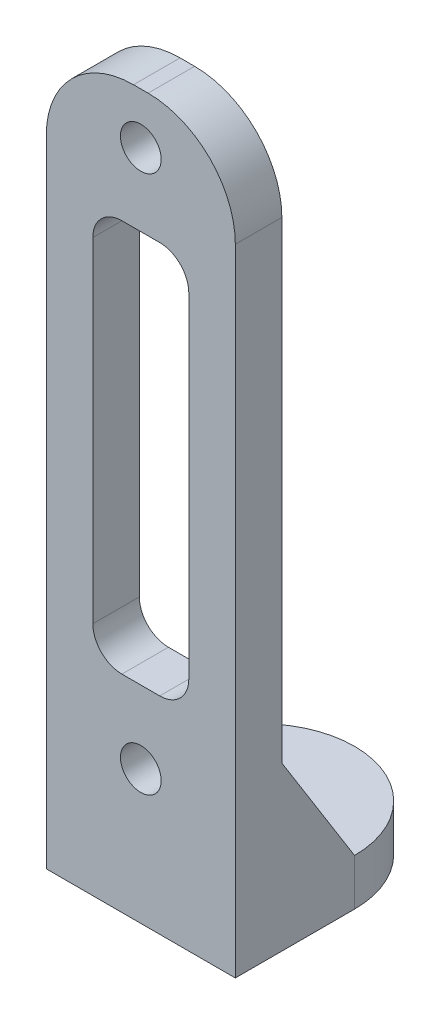
from build123d import *

# Parameters (mm, degrees)
SKETCH1_R           = 1.4
BOSS_EXTRUDE1_DEPTH = 3.2
SKETCH2_R           = 1.65
BOSS_EXTRUDE3_DEPTH = 3.2
BOSS_EXTRUDE4_DEPTH = 2
LPATTERN1_COUNT     = 2
LPATTERN1_PITCH     = 11
CUT_EXTRUDE1_DEPTH  = 50.633657935


with BuildPart() as part:
    # Sketch1 → Boss-Extrude1 (new body)
    with BuildSketch(Plane.XY):
        with BuildLine():
            Line((0, 0), (13, 0))
            Line((13, 0), (13, 40.5))
            ThreePointArc((13, 40.5), (11.242640687, 44.742640687), (7, 46.5))
            Line((7, 46.5), (6, 46.5))
            ThreePointArc((6, 46.5), (1.757359313, 44.742640687), (0, 40.5))
            Line((0, 40.5), (0, 0))
        make_face()
        with Locations((6.5, 6)):
            Circle(SKETCH1_R, mode=Mode.SUBTRACT)
        with Locations((6.5, 43)):
            Circle(SKETCH1_R, mode=Mode.SUBTRACT)
    extrude(amount=BOSS_EXTRUDE1_DEPTH)

    # Sketch2 → Boss-Extrude3 (add)
    with BuildSketch(Plane(origin=(0, 0, 0), x_dir=(1, 0, 0), z_dir=(0, 1, 0))):
        with BuildLine():
            Line((0, 5), (0, -3.2))
            Line((0, -3.2), (13, -3.2))
            Line((13, -3.2), (13, 5))
            ThreePointArc((13, 5), (6.5, 11.5), (0, 5))
        make_face()
        with Locations(Location((6.5, 5, 0), (0, 0, 270))):
            Circle(SKETCH2_R, mode=Mode.SUBTRACT)
    extrude(amount=-BOSS_EXTRUDE3_DEPTH)

    # Sketch3 → Boss-Extrude4 (add)
    with BuildSketch(Plane(origin=(0, 0, 0), x_dir=(0, 0, -1), z_dir=(1, 0, 0))):
        Polygon((0, 0), (5, 0), (0, 8), align=None)
    boss_extrude4 = extrude(amount=BOSS_EXTRUDE4_DEPTH)

    # LPattern1: Boss-Extrude4 ×2
    with Locations(*[(i * LPATTERN1_PITCH, 0, 0) for i in range(1, LPATTERN1_COUNT)]):
        add(boss_extrude4)

    # Sketch4 → Cut-Extrude1 (cut, through all)
    with BuildSketch(Plane.XY):
        with BuildLine():
            Line((5.2, 38), (7.8, 38))
            ThreePointArc((7.8, 38), (9.214213562, 37.414213562), (9.8, 36))
            Line((9.8, 36), (9.8, 13))
            ThreePointArc((9.8, 13), (9.214213562, 11.585786438), (7.8, 11))
            Line((7.8, 11), (5.2, 11))
            ThreePointArc((5.2, 11), (3.785786438, 11.585786438), (3.2, 13))
            Line((3.2, 13), (3.2, 36))
            ThreePointArc((3.2, 36), (3.785786438, 37.414213562), (5.2, 38))
        make_face()
    extrude(amount=CUT_EXTRUDE1_DEPTH, mode=Mode.SUBTRACT)


solid = part.part
